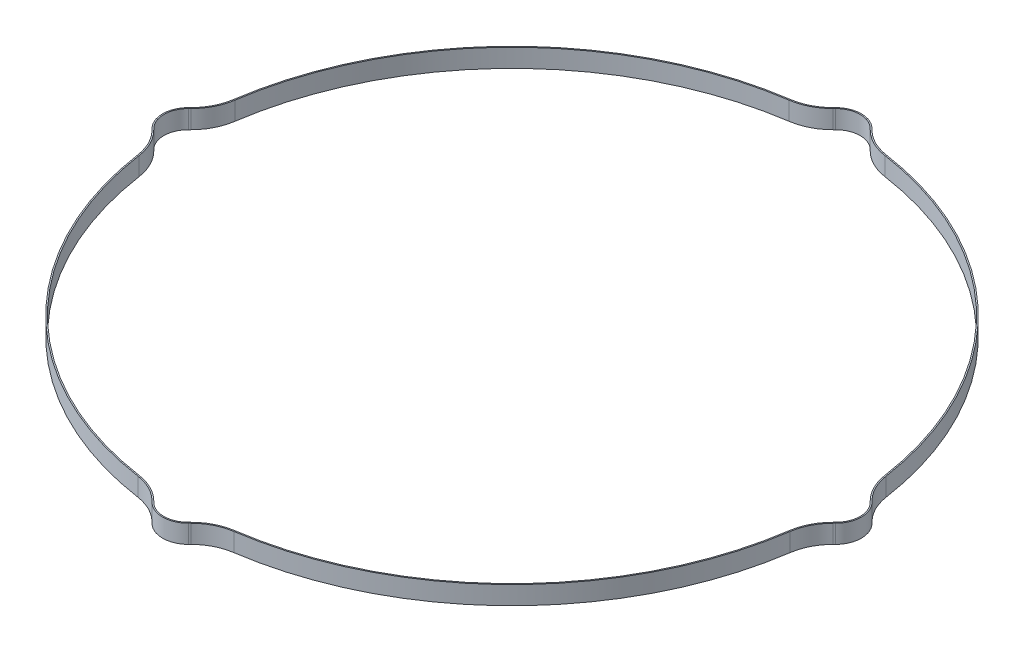
from build123d import *

# Parameters (mm, degrees)
EXTRUDE_THIN1_DEPTH = 38.1


with BuildPart() as part:
    # Sketch1 → Extrude-Thin1 (new body)
    with BuildSketch(Plane(origin=(0, 0, 0), x_dir=(1, 0, 0), z_dir=(0, 1, 0))):
        with BuildLine():
            Line((40.452514176, 707.631658817), (37.717075708, 710.367097284))
            ThreePointArc((37.717075708, 710.367097284), (0, 725.990021576), (-37.717075708, 710.367097284))
            Line((-37.717075708, 710.367097284), (-40.452514176, 707.631658817))
            ThreePointArc((-40.452514176, 707.631658817), (-67.656084524, 687.982343635), (-99.656821316, 677.878746672))
            ThreePointArc((-99.656821316, 677.878746672), (-484.484817732, 484.484817732), (-677.878746672, 99.656821316))
            ThreePointArc((-677.878746672, 99.656821316), (-687.982343635, 67.656084524), (-707.631658817, 40.452514176))
            Line((-707.631658817, 40.452514176), (-710.367097284, 37.717075708))
            ThreePointArc((-710.367097284, 37.717075708), (-725.990021576, 0), (-710.367097284, -37.717075708))
            Line((-710.367097284, -37.717075708), (-707.631658817, -40.452514176))
            ThreePointArc((-707.631658817, -40.452514176), (-687.982343635, -67.656084524), (-677.878746672, -99.656821316))
            ThreePointArc((-677.878746672, -99.656821316), (-484.484817732, -484.484817732), (-99.656821316, -677.878746672))
            ThreePointArc((-99.656821316, -677.878746672), (-67.656084524, -687.982343635), (-40.452514176, -707.631658817))
            Line((-40.452514176, -707.631658817), (-37.717075708, -710.367097284))
            ThreePointArc((-37.717075708, -710.367097284), (0, -725.990021576), (37.717075708, -710.367097284))
            Line((37.717075708, -710.367097284), (40.452514176, -707.631658817))
            ThreePointArc((40.452514176, -707.631658817), (67.656084524, -687.982343635), (99.656821316, -677.878746672))
            ThreePointArc((99.656821316, -677.878746672), (484.484817732, -484.484817732), (677.878746672, -99.656821316))
            ThreePointArc((677.878746672, -99.656821316), (687.982343635, -67.656084524), (707.631658817, -40.452514176))
            Line((707.631658817, -40.452514176), (710.367097284, -37.717075708))
            ThreePointArc((710.367097284, -37.717075708), (725.990021576, 0), (710.367097284, 37.717075708))
            Line((710.367097284, 37.717075708), (707.631658817, 40.452514176))
            ThreePointArc((707.631658817, 40.452514176), (687.982343635, 67.656084524), (677.878746672, 99.656821316))
            ThreePointArc((677.878746672, 99.656821316), (484.484817732, 484.484817732), (99.656821316, 677.878746672))
            ThreePointArc((99.656821316, 677.878746672), (67.656084524, 687.982343635), (40.452514176, 707.631658817))
        make_face()
        with BuildLine():
            Line((38.656462951, 705.835607593), (35.921024484, 708.57104606))
            ThreePointArc((35.921024484, 708.57104606), (0, 723.450021576), (-35.921024484, 708.57104606))
            Line((-35.921024484, 708.57104606), (-38.656462951, 705.835607593))
            ThreePointArc((-38.656462951, 705.835607593), (-66.515541019, 685.712814936), (-99.287379903, 675.365757806))
            ThreePointArc((-99.287379903, 675.365757806), (-482.688766507, 482.688766507), (-675.365757806, 99.287379903))
            ThreePointArc((-675.365757806, 99.287379903), (-685.712814936, 66.515541019), (-705.835607593, 38.656462951))
            Line((-705.835607593, 38.656462951), (-708.57104606, 35.921024484))
            ThreePointArc((-708.57104606, 35.921024484), (-723.450021576, 0), (-708.57104606, -35.921024484))
            Line((-708.57104606, -35.921024484), (-705.835607593, -38.656462951))
            ThreePointArc((-705.835607593, -38.656462951), (-685.712814936, -66.515541019), (-675.365757806, -99.287379903))
            ThreePointArc((-675.365757806, -99.287379903), (-482.688766507, -482.688766507), (-99.287379903, -675.365757806))
            ThreePointArc((-99.287379903, -675.365757806), (-66.515541019, -685.712814936), (-38.656462951, -705.835607593))
            Line((-38.656462951, -705.835607593), (-35.921024484, -708.57104606))
            ThreePointArc((-35.921024484, -708.57104606), (0, -723.450021576), (35.921024484, -708.57104606))
            Line((35.921024484, -708.57104606), (38.656462951, -705.835607593))
            ThreePointArc((38.656462951, -705.835607593), (66.515541019, -685.712814936), (99.287379903, -675.365757806))
            ThreePointArc((99.287379903, -675.365757806), (482.688766507, -482.688766507), (675.365757806, -99.287379903))
            ThreePointArc((675.365757806, -99.287379903), (685.712814936, -66.515541019), (705.835607593, -38.656462951))
            Line((705.835607593, -38.656462951), (708.57104606, -35.921024484))
            ThreePointArc((708.57104606, -35.921024484), (723.450021576, 0), (708.57104606, 35.921024484))
            Line((708.57104606, 35.921024484), (705.835607593, 38.656462951))
            ThreePointArc((705.835607593, 38.656462951), (685.712814936, 66.515541019), (675.365757806, 99.287379903))
            ThreePointArc((675.365757806, 99.287379903), (482.688766507, 482.688766507), (99.287379903, 675.365757806))
            ThreePointArc((99.287379903, 675.365757806), (66.515541019, 685.712814936), (38.656462951, 705.835607593))
        make_face(mode=Mode.SUBTRACT)
    extrude(amount=EXTRUDE_THIN1_DEPTH)


solid = part.part
